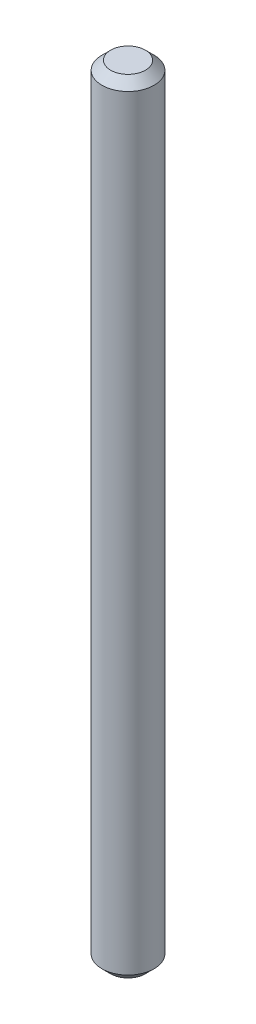
from build123d import *

# Parameters (mm, degrees)
SKETCH1_R           = 3
BOSS_EXTRUDE1_DEPTH = 90
CHAMFER1_SIZE       = 1


with BuildPart() as part:
    # Sketch1 → Boss-Extrude1 (new body)
    with BuildSketch(Plane(origin=(0, 0, 0), x_dir=(1, 0, 0), z_dir=(0, 1, 0))):
        with Locations(Location((0, 0, 0), (0, 0, 90))):
            Circle(SKETCH1_R)
    extrude(amount=BOSS_EXTRUDE1_DEPTH)

    # Chamfer1
    chamfer1_edges = [part.edges().sort_by_distance(p)[0] for p in [
        (0, 0, 3),
        (0, 90, 3),
    ]]
    chamfer(chamfer1_edges, length=CHAMFER1_SIZE)


solid = part.part
